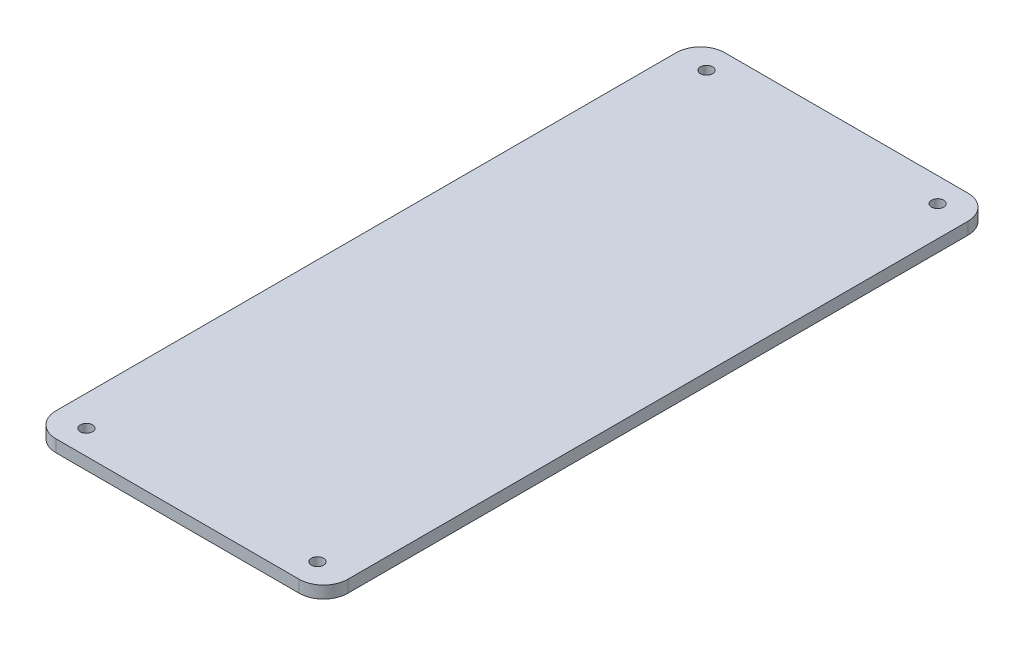
from build123d import *

# Parameters (mm, degrees)
SKETCH1_R           = 1.5
BOSS_EXTRUDE1_DEPTH = 3


with BuildPart() as part:
    # Sketch1 → Boss-Extrude1 (new body)
    with BuildSketch(Plane(origin=(0, 0, 0), x_dir=(1, 0, 0), z_dir=(0, 1, 0))):
        with BuildLine():
            Line((-30, -82.5), (30, -82.5))
            ThreePointArc((30, -82.5), (34.242640687, -80.742640687), (36, -76.5))
            Line((36, -76.5), (36, 76.5))
            ThreePointArc((36, 76.5), (34.242640687, 80.742640687), (30, 82.5))
            Line((30, 82.5), (-30, 82.5))
            ThreePointArc((-30, 82.5), (-34.242640687, 80.742640687), (-36, 76.5))
            Line((-36, 76.5), (-36, -76.5))
            ThreePointArc((-36, -76.5), (-34.242640687, -80.742640687), (-30, -82.5))
        make_face()
        with Locations(Location((28.5, -76.5, 0), (0, 0, 270))):
            Circle(SKETCH1_R, mode=Mode.SUBTRACT)
        with Locations(Location((-28.5, -76.5, 0), (0, 0, 270))):
            Circle(SKETCH1_R, mode=Mode.SUBTRACT)
        with Locations(Location((28.5, 76.5, 0), (0, 0, 270))):
            Circle(SKETCH1_R, mode=Mode.SUBTRACT)
        with Locations(Location((-28.5, 76.5, 0), (0, 0, 270))):
            Circle(SKETCH1_R, mode=Mode.SUBTRACT)
    extrude(amount=BOSS_EXTRUDE1_DEPTH)


solid = part.part
